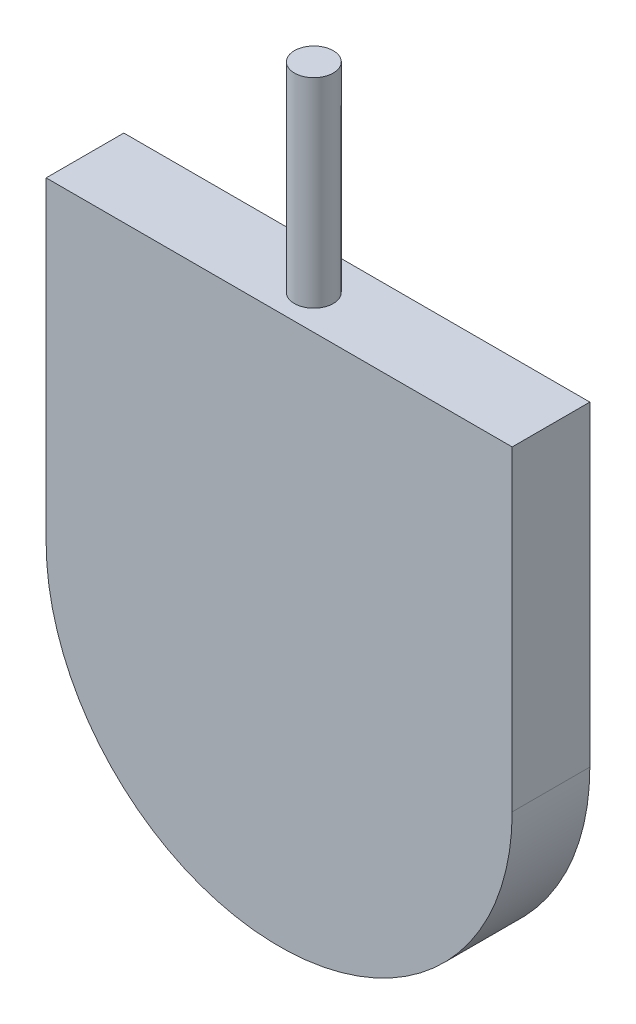
from build123d import *

# Parameters (mm, degrees)
BOSS_EXTRUDE1_DEPTH = 12.7
SKETCH2_R           = 3.175
BOSS_EXTRUDE2_DEPTH = 84.328


with BuildPart() as part:
    # Sketch1 → Boss-Extrude1 (new body)
    with BuildSketch(Plane.XY):
        with BuildLine():
            Line((-38.1, 0), (-38.1, 51.682449807))
            Line((-38.1, 51.682449807), (38.1, 51.682449807))
            Line((38.1, 51.682449807), (38.1, 0))
            ThreePointArc((38.1, 0), (0, -38.1), (-38.1, 0))
        make_face()
    extrude(amount=BOSS_EXTRUDE1_DEPTH)

    # Sketch2 → Boss-Extrude2 (add)
    with BuildSketch(Plane(origin=(0, 0, 0), x_dir=(1, 0, 0), z_dir=(0, 1, 0))):
        with Locations(Location((0, -7.032046272, 0), (0, 0, 90))):
            Circle(SKETCH2_R)
    extrude(amount=BOSS_EXTRUDE2_DEPTH)


solid = part.part
